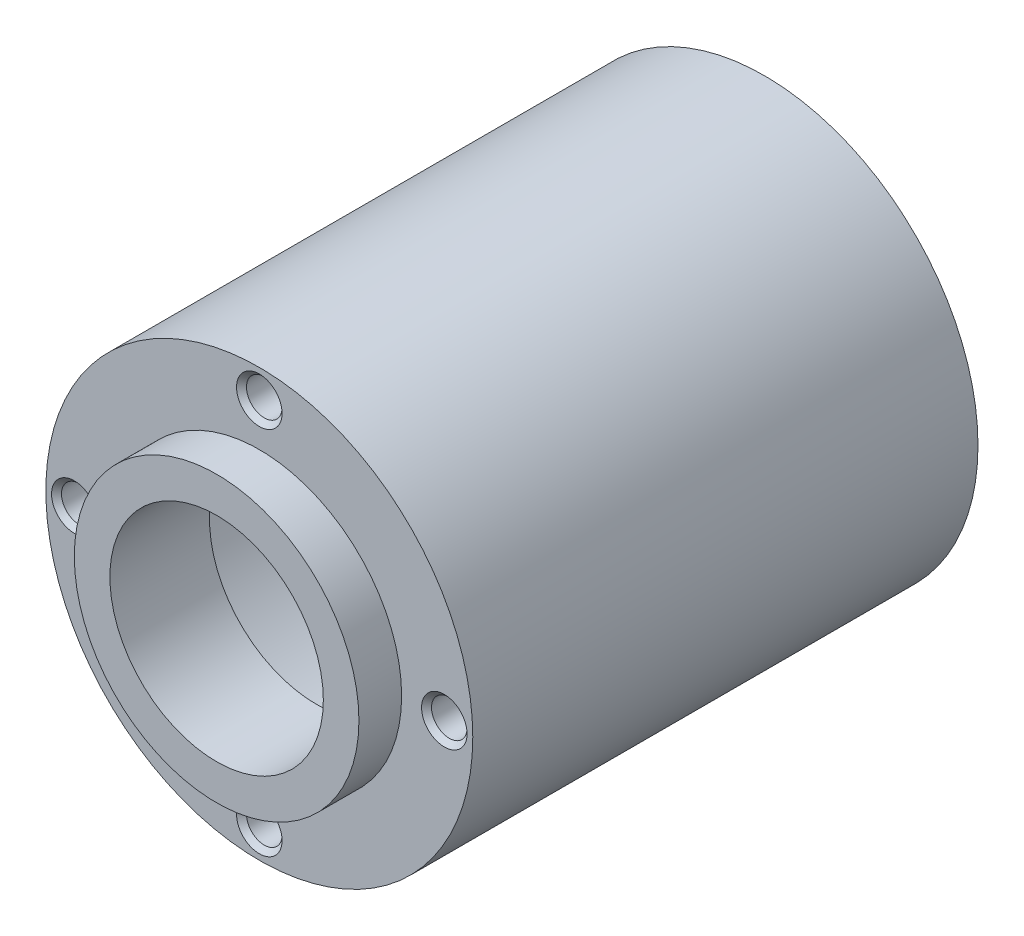
from build123d import *

# Parameters (mm, degrees)
SKETCH1_R                       = 15
BOSS_EXTRUDE1_DEPTH             = 35.5
SKETCH2_R                       = 14.2
CUT_EXTRUDE1_DEPTH              = 31.5
SKETCH3_R                       = 7.5
CUT_EXTRUDE2_DEPTH              = 42.355168964
M3X0_5_TAPPED_HOLE1_D           = 2.5
M3X0_5_TAPPED_HOLE1_CSINK_D     = 3.2
M3X0_5_TAPPED_HOLE1_CSINK_ANGLE = 90
CIRPATTERN2_COUNT               = 4
BOSS_EXTRUDE2_START             = 3
SKETCH8_R                       = 10
SKETCH8_R_2                     = 7.5
BOSS_EXTRUDE2_DEPTH             = 3


with BuildPart() as part:
    # Sketch1 → Boss-Extrude1 (new body)
    with BuildSketch(Plane.XY):
        Circle(SKETCH1_R)
    extrude(amount=-BOSS_EXTRUDE1_DEPTH)

    # Sketch2 → Cut-Extrude1 (cut)
    with BuildSketch(Plane.XY.offset(-35.5)):
        Circle(SKETCH2_R)
    extrude(amount=CUT_EXTRUDE1_DEPTH, mode=Mode.SUBTRACT)

    # Sketch3 → Cut-Extrude2 (cut, through all)
    with BuildSketch(Plane(origin=(0, 0, 0), x_dir=(-1, 0, 0), z_dir=(0, 0, -1))):
        with Locations(Location((0, 0, 0), (0, 0, 180))):
            Circle(SKETCH3_R)
    extrude(amount=CUT_EXTRUDE2_DEPTH, mode=Mode.SUBTRACT)

    # M3x0.5 Tapped Hole1 (through all)
    with Locations(Plane(origin=(0, 0, 0), x_dir=(-1, 0, 0), z_dir=(0, 0, 1))):
        with Locations((-13, 0)):
            m3x0_5_tapped_hole1 = CounterSinkHole(M3X0_5_TAPPED_HOLE1_D / 2, M3X0_5_TAPPED_HOLE1_CSINK_D / 2, counter_sink_angle=M3X0_5_TAPPED_HOLE1_CSINK_ANGLE)

    # CirPattern2: M3x0.5 Tapped Hole1 ×4 about axis
    cirpattern2_axis = Axis((0, 0, 0), (0, 0, 1))
    for i in range(1, CIRPATTERN2_COUNT):
        add(m3x0_5_tapped_hole1.rotate(cirpattern2_axis, i * 360 / CIRPATTERN2_COUNT), mode=Mode.SUBTRACT)

    # Sketch8 → Boss-Extrude2 (add)
    with BuildSketch(Plane.XY.offset(BOSS_EXTRUDE2_START)):
        Circle(SKETCH8_R)
        Circle(SKETCH8_R_2, mode=Mode.SUBTRACT)
    extrude(amount=-BOSS_EXTRUDE2_DEPTH)


solid = part.part
